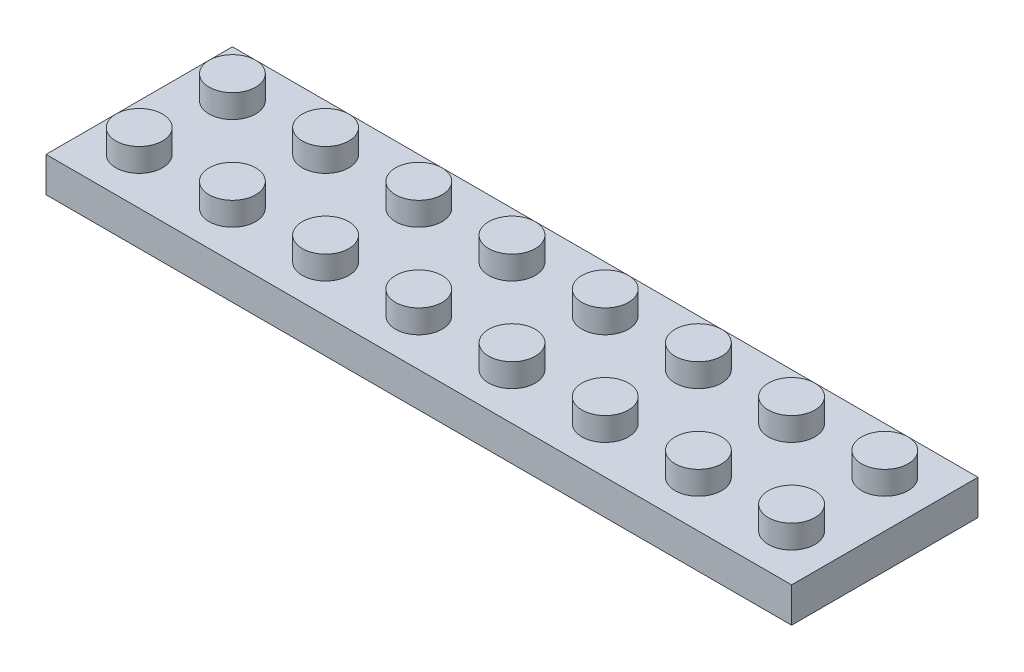
from build123d import *

# Parameters (mm, degrees)
SKETCH1_W           = 64
SKETCH1_H           = 16
SKETCH1_R           = 2
BOSS_EXTRUDE1_DEPTH = 3
SKETCH1_3_R         = 2
BOSS_EXTRUDE2_DEPTH = 5
SHELL1_T            = -1
SKETCH2_R           = 2.8
SKETCH2_R_2         = 1.8
BOSS_EXTRUDE3_DEPTH = 2


with BuildPart() as part:
    # Sketch1 → Boss-Extrude1 (new body)
    # profile 1 of 17: a face of its own
    with BuildSketch(Plane(origin=(0, 0, 0), x_dir=(1, 0, 0), z_dir=(0, 1, 0))):
        Rectangle(SKETCH1_W, SKETCH1_H)
        with Locations((-20, -4)):
            Circle(SKETCH1_R, mode=Mode.SUBTRACT)
        with Locations((-4, -4)):
            Circle(SKETCH1_R, mode=Mode.SUBTRACT)
        with Locations((12, -4)):
            Circle(SKETCH1_R, mode=Mode.SUBTRACT)
        with Locations((28, -4)):
            Circle(SKETCH1_R, mode=Mode.SUBTRACT)
        with Locations((-28, 4)):
            Circle(SKETCH1_R, mode=Mode.SUBTRACT)
        with Locations((-20, 4)):
            Circle(SKETCH1_R, mode=Mode.SUBTRACT)
        with Locations((-12, 4)):
            Circle(SKETCH1_R, mode=Mode.SUBTRACT)
        with Locations((-4, 4)):
            Circle(SKETCH1_R, mode=Mode.SUBTRACT)
        with Locations((4, 4)):
            Circle(SKETCH1_R, mode=Mode.SUBTRACT)
        with Locations((12, 4)):
            Circle(SKETCH1_R, mode=Mode.SUBTRACT)
        with Locations((20, 4)):
            Circle(SKETCH1_R, mode=Mode.SUBTRACT)
        with Locations((28, 4)):
            Circle(SKETCH1_R, mode=Mode.SUBTRACT)
        with Locations((20, -4)):
            Circle(SKETCH1_R, mode=Mode.SUBTRACT)
        with Locations((4, -4)):
            Circle(SKETCH1_R, mode=Mode.SUBTRACT)
        with Locations((-12, -4)):
            Circle(SKETCH1_R, mode=Mode.SUBTRACT)
        with Locations((-28, -4)):
            Circle(SKETCH1_R, mode=Mode.SUBTRACT)
    # profile 2 of 17: a face of its own
    with BuildSketch(Plane(origin=(0, 0, 0), x_dir=(1, 0, 0), z_dir=(0, 1, 0))):
        with Locations((-28, -4)):
            Circle(SKETCH1_R)
    # profile 3 of 17: a face of its own
    with BuildSketch(Plane(origin=(0, 0, 0), x_dir=(1, 0, 0), z_dir=(0, 1, 0))):
        with Locations((-28, 4)):
            Circle(SKETCH1_R)
    # profile 4 of 17: a face of its own
    with BuildSketch(Plane(origin=(0, 0, 0), x_dir=(1, 0, 0), z_dir=(0, 1, 0))):
        with Locations((-20, 4)):
            Circle(SKETCH1_R)
    # profile 5 of 17: a face of its own
    with BuildSketch(Plane(origin=(0, 0, 0), x_dir=(1, 0, 0), z_dir=(0, 1, 0))):
        with Locations((-20, -4)):
            Circle(SKETCH1_R)
    # profile 6 of 17: a face of its own
    with BuildSketch(Plane(origin=(0, 0, 0), x_dir=(1, 0, 0), z_dir=(0, 1, 0))):
        with Locations((-12, -4)):
            Circle(SKETCH1_R)
    # profile 7 of 17: a face of its own
    with BuildSketch(Plane(origin=(0, 0, 0), x_dir=(1, 0, 0), z_dir=(0, 1, 0))):
        with Locations((-12, 4)):
            Circle(SKETCH1_R)
    # profile 8 of 17: a face of its own
    with BuildSketch(Plane(origin=(0, 0, 0), x_dir=(1, 0, 0), z_dir=(0, 1, 0))):
        with Locations((-4, -4)):
            Circle(SKETCH1_R)
    # profile 9 of 17: a face of its own
    with BuildSketch(Plane(origin=(0, 0, 0), x_dir=(1, 0, 0), z_dir=(0, 1, 0))):
        with Locations((-4, 4)):
            Circle(SKETCH1_R)
    # profile 10 of 17: a face of its own
    with BuildSketch(Plane(origin=(0, 0, 0), x_dir=(1, 0, 0), z_dir=(0, 1, 0))):
        with Locations((4, -4)):
            Circle(SKETCH1_R)
    # profile 11 of 17: a face of its own
    with BuildSketch(Plane(origin=(0, 0, 0), x_dir=(1, 0, 0), z_dir=(0, 1, 0))):
        with Locations((4, 4)):
            Circle(SKETCH1_R)
    # profile 12 of 17: a face of its own
    with BuildSketch(Plane(origin=(0, 0, 0), x_dir=(1, 0, 0), z_dir=(0, 1, 0))):
        with Locations((12, 4)):
            Circle(SKETCH1_R)
    # profile 13 of 17: a face of its own
    with BuildSketch(Plane(origin=(0, 0, 0), x_dir=(1, 0, 0), z_dir=(0, 1, 0))):
        with Locations((20, -4)):
            Circle(SKETCH1_R)
    # profile 14 of 17: a face of its own
    with BuildSketch(Plane(origin=(0, 0, 0), x_dir=(1, 0, 0), z_dir=(0, 1, 0))):
        with Locations((20, 4)):
            Circle(SKETCH1_R)
    # profile 15 of 17: a face of its own
    with BuildSketch(Plane(origin=(0, 0, 0), x_dir=(1, 0, 0), z_dir=(0, 1, 0))):
        with Locations((28, 4)):
            Circle(SKETCH1_R)
    # profile 16 of 17: a face of its own
    with BuildSketch(Plane(origin=(0, 0, 0), x_dir=(1, 0, 0), z_dir=(0, 1, 0))):
        with Locations((28, -4)):
            Circle(SKETCH1_R)
    # profile 17 of 17: a face of its own
    with BuildSketch(Plane(origin=(0, 0, 0), x_dir=(1, 0, 0), z_dir=(0, 1, 0))):
        with Locations((12, -4)):
            Circle(SKETCH1_R)
    extrude(amount=BOSS_EXTRUDE1_DEPTH)

    # Sketch1<3> → Boss-Extrude2 (add)
    with BuildSketch(Plane(origin=(0, 0, 0), x_dir=(1, 0, 0), z_dir=(0, 1, 0))):
        with Locations(Location((-28, 4, 0), (0, 0, 270))):
            Circle(SKETCH1_3_R)
        with Locations(Location((-28, -4, 0), (0, 0, 270))):
            Circle(SKETCH1_3_R)
        with Locations(Location((-20, -4, 0), (0, 0, 270))):
            Circle(SKETCH1_3_R)
        with Locations(Location((-20, 4, 0), (0, 0, 270))):
            Circle(SKETCH1_3_R)
        with Locations(Location((-12, 4, 0), (0, 0, 270))):
            Circle(SKETCH1_3_R)
        with Locations(Location((-12, -4, 0), (0, 0, 270))):
            Circle(SKETCH1_3_R)
        with Locations(Location((-4, 4, 0), (0, 0, 270))):
            Circle(SKETCH1_3_R)
        with Locations(Location((-4, -4, 0), (0, 0, 270))):
            Circle(SKETCH1_3_R)
        with Locations(Location((4, 4, 0), (0, 0, 270))):
            Circle(SKETCH1_3_R)
        with Locations(Location((4, -4, 0), (0, 0, 270))):
            Circle(SKETCH1_3_R)
        with Locations(Location((12, 4, 0), (0, 0, 270))):
            Circle(SKETCH1_3_R)
        with Locations(Location((12, -4, 0), (0, 0, 270))):
            Circle(SKETCH1_3_R)
        with Locations(Location((20, 4, 0), (0, 0, 270))):
            Circle(SKETCH1_3_R)
        with Locations(Location((20, -4, 0), (0, 0, 270))):
            Circle(SKETCH1_3_R)
        with Locations(Location((28, -4, 0), (0, 0, 270))):
            Circle(SKETCH1_3_R)
        with Locations(Location((28, 4, 0), (0, 0, 270))):
            Circle(SKETCH1_3_R)
    extrude(amount=BOSS_EXTRUDE2_DEPTH)

    # Shell1
    shell1_openings = [part.faces().sort_by_distance(p)[0] for p in [
        (0, 0, 0),
    ]]
    offset(amount=SHELL1_T, openings=shell1_openings, kind=Kind.INTERSECTION)

    # Sketch2 → Boss-Extrude3 (add)
    # profile 1 of 7: a face of its own
    with BuildSketch(Plane.XZ.offset(-2)):
        with Locations(Location((-24, 0, 0), (0, 0, 90))):
            Circle(SKETCH2_R)
        with Locations(Location((-24, 0, 0), (0, 0, 90))):
            Circle(SKETCH2_R_2, mode=Mode.SUBTRACT)
    # profile 2 of 7: a face of its own
    with BuildSketch(Plane.XZ.offset(-2)):
        with Locations(Location((-16, 0, 0), (0, 0, 90))):
            Circle(SKETCH2_R)
        with Locations(Location((-16, 0, 0), (0, 0, 90))):
            Circle(SKETCH2_R_2, mode=Mode.SUBTRACT)
    # profile 3 of 7: a face of its own
    with BuildSketch(Plane.XZ.offset(-2)):
        with Locations(Location((-8, 0, 0), (0, 0, 90))):
            Circle(SKETCH2_R)
        with Locations(Location((-8, 0, 0), (0, 0, 90))):
            Circle(SKETCH2_R_2, mode=Mode.SUBTRACT)
    # profile 4 of 7: a face of its own
    with BuildSketch(Plane.XZ.offset(-2)):
        with Locations(Location((0, 0, 0), (0, 0, 90))):
            Circle(SKETCH2_R)
        with Locations(Location((0, 0, 0), (0, 0, 90))):
            Circle(SKETCH2_R_2, mode=Mode.SUBTRACT)
    # profile 5 of 7: a face of its own
    with BuildSketch(Plane.XZ.offset(-2)):
        with Locations(Location((8, 0, 0), (0, 0, 90))):
            Circle(SKETCH2_R)
        with Locations(Location((8, 0, 0), (0, 0, 90))):
            Circle(SKETCH2_R_2, mode=Mode.SUBTRACT)
    # profile 6 of 7: a face of its own
    with BuildSketch(Plane.XZ.offset(-2)):
        with Locations(Location((16, 0, 0), (0, 0, 90))):
            Circle(SKETCH2_R)
        with Locations(Location((16, 0, 0), (0, 0, 90))):
            Circle(SKETCH2_R_2, mode=Mode.SUBTRACT)
    # profile 7 of 7: a face of its own
    with BuildSketch(Plane.XZ.offset(-2)):
        with Locations(Location((24, 0, 0), (0, 0, 90))):
            Circle(SKETCH2_R)
        with Locations(Location((24, 0, 0), (0, 0, 90))):
            Circle(SKETCH2_R_2, mode=Mode.SUBTRACT)
    extrude(amount=BOSS_EXTRUDE3_DEPTH)


solid = part.part
